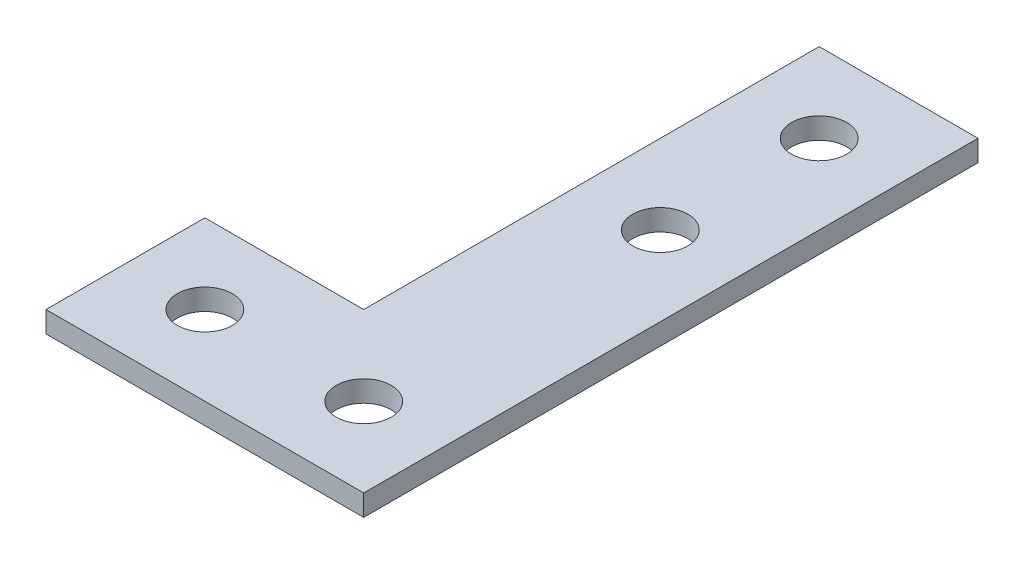
from build123d import *

# Parameters (mm, degrees)
SKETCH_1_R      = 2.6
SKETCH_1_W      = 15
SKETCH_1_H      = 15
EXTRUDE_1_DEPTH = 2


with BuildPart() as part:
    # 草图1 → 凸台-拉伸1 (new body)
    # profile 1 of 2: a face of its own
    with BuildSketch(Plane(origin=(0, 0, 0), x_dir=(1, 0, 0), z_dir=(0, 1, 0))):
        Polygon((7.5, -15), (7.5, 0), (7.5, 13), (7.5, 28), (-7.5, 28), (-7.5, 13), (-7.5, 0), (-22.5, 0), (-22.5, -15), align=None)
        with Locations(Location((-15, -7.5, 0), (0, 0, 270))):
            Circle(SKETCH_1_R, mode=Mode.SUBTRACT)
        with Locations(Location((0, -7.5, 0), (0, 0, 270))):
            Circle(SKETCH_1_R, mode=Mode.SUBTRACT)
        with Locations(Location((0, 20.5, 0), (0, 0, 270))):
            Circle(SKETCH_1_R, mode=Mode.SUBTRACT)
    # profile 2 of 2: a face of its own
    with BuildSketch(Plane(origin=(0, 0, 0), x_dir=(1, 0, 0), z_dir=(0, 1, 0))):
        with Locations((0, 35.5)):
            Rectangle(SKETCH_1_W, SKETCH_1_H)
        with Locations(Location((0, 35.5, 0), (0, 0, 270))):
            Circle(SKETCH_1_R, mode=Mode.SUBTRACT)
    extrude(amount=EXTRUDE_1_DEPTH)


solid = part.part
